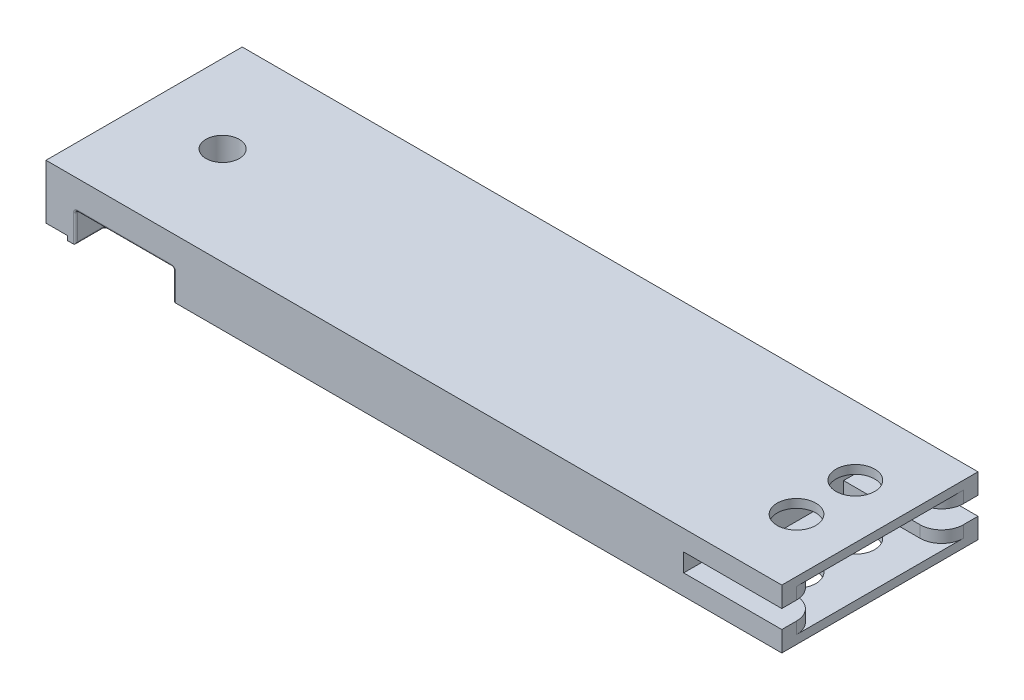
from build123d import *

# Parameters (mm, degrees)
SKETCH1_W            = 20
SKETCH1_H            = 6
BOSS_EXTRUDE1_DEPTH  = 75
M3_CLEARANCE_HOLE1_D = 3.4
SKETCH4_R            = 1.975
CUT_EXTRUDE1_DEPTH   = 76.901251637
CUT_EXTRUDE2_DEPTH   = 10
SKETCH6_W            = 10
SKETCH6_H            = 3
CUT_EXTRUDE3_DEPTH   = 3
FILLET1_R            = 0.2
FILLET2_R            = 2.2
CUT_EXTRUDE5_DEPTH   = 2.2


with BuildPart() as part:
    # Sketch1 → Boss-Extrude1 (new body)
    with BuildSketch(Plane(origin=(0, 0, 0), x_dir=(0, 0, -1), z_dir=(1, 0, 0))):
        with Locations((0, -3)):
            Rectangle(SKETCH1_W, SKETCH1_H)
    extrude(amount=BOSS_EXTRUDE1_DEPTH)

    # M3 Clearance Hole1 (through all)
    with Locations(Plane(origin=(0, 0, 0), x_dir=(1, 0, 0), z_dir=(0, 1, 0))):
        with Locations((8, 0)):
            Hole(M3_CLEARANCE_HOLE1_D / 2)

    # Sketch4 → Cut-Extrude1 (cut, through all)
    with BuildSketch(Plane(origin=(0, 0, 0), x_dir=(1, 0, 0), z_dir=(0, 1, 0))):
        with Locations(Location((69.5, 3, 0), (0, 0, 270))):
            Circle(SKETCH4_R)
        with Locations(Location((69.5, -3, 0), (0, 0, 270))):
            Circle(SKETCH4_R)
    extrude(amount=-CUT_EXTRUDE1_DEPTH, mode=Mode.SUBTRACT)

    # Sketch5 → Cut-Extrude2 (cut)
    with BuildSketch(Plane(origin=(75, 0, 0), x_dir=(0, 0, -1), z_dir=(1, 0, 0))):
        Polygon((-10, -3.925), (-6.3, -3.925), (-6.3, -5.125), (6.3, -5.125), (6.3, -3.925), (10, -3.925), (10, -2.075), (6.3, -2.075), (6.3, -0.875), (-6.3, -0.875), (-6.3, -2.075), (-10, -2.075), align=None)
    extrude(amount=-CUT_EXTRUDE2_DEPTH, mode=Mode.SUBTRACT)

    # Sketch6 → Cut-Extrude3 (cut)
    with BuildSketch(Plane.XZ.offset(6)):
        with Locations((8, 8.5)):
            Rectangle(SKETCH6_W, SKETCH6_H)
        with Locations((8, -8.5)):
            Rectangle(SKETCH6_W, SKETCH6_H)
    extrude(amount=-CUT_EXTRUDE3_DEPTH, mode=Mode.SUBTRACT)

    # Fillet1
    fillet1_edges = [part.edges().sort_by_distance(p)[0] for p in [
        (3, -3, 8.5),
        (3, -4.5, 7),
        (8, -3, 10),
        (3, -4.5, 10),
        (13, -3, 8.5),
        (13, -4.5, 10),
        (8, -3, 7),
        (13, -4.5, 7),
        (3, -6, 8.5),
        (8, -6, 7),
        (13, -6, 8.5),
        (13, -3, -8.5),
        (13, -4.5, -7),
        (8, -3, -10),
        (13, -4.5, -10),
        (3, -3, -8.5),
        (3, -4.5, -10),
        (8, -3, -7),
        (3, -4.5, -7),
        (13, -6, -8.5),
        (8, -6, -7),
        (3, -6, -8.5),
    ]]
    fillet(fillet1_edges, radius=FILLET1_R)

    # Fillet2
    fillet2_edges = [part.edges().sort_by_distance(p)[0] for p in [
        (75, -1.475, -6.3),
        (75, -1.475, 6.3),
        (75, -4.525, 6.3),
        (75, -4.525, -6.3),
    ]]
    fillet(fillet2_edges, radius=FILLET2_R)

    # Sketch12 → Cut-Extrude5 (cut)
    with BuildSketch(Plane.ZY):
        with BuildLine():
            ThreePointArc((10, -5.554612339), (0, -2.6), (-10, -5.554612339))
            Line((-10, -5.554612339), (-10, -6))
            Line((-10, -6), (10, -6))
            Line((10, -6), (10, -5.554612339))
        make_face()
        with BuildLine():
            Line((-10, -6), (-10, -5.554612339))
            ThreePointArc((-10, -5.554612339), (-8.79090439, -37.164157881), (18.4, -21))
            ThreePointArc((18.4, -21), (16.164157881, -12.20909561), (10, -5.554612339))
            Line((10, -5.554612339), (10, -6))
            Line((10, -6), (-10, -6))
        make_face()
    extrude(amount=-CUT_EXTRUDE5_DEPTH, mode=Mode.SUBTRACT)


solid = part.part
